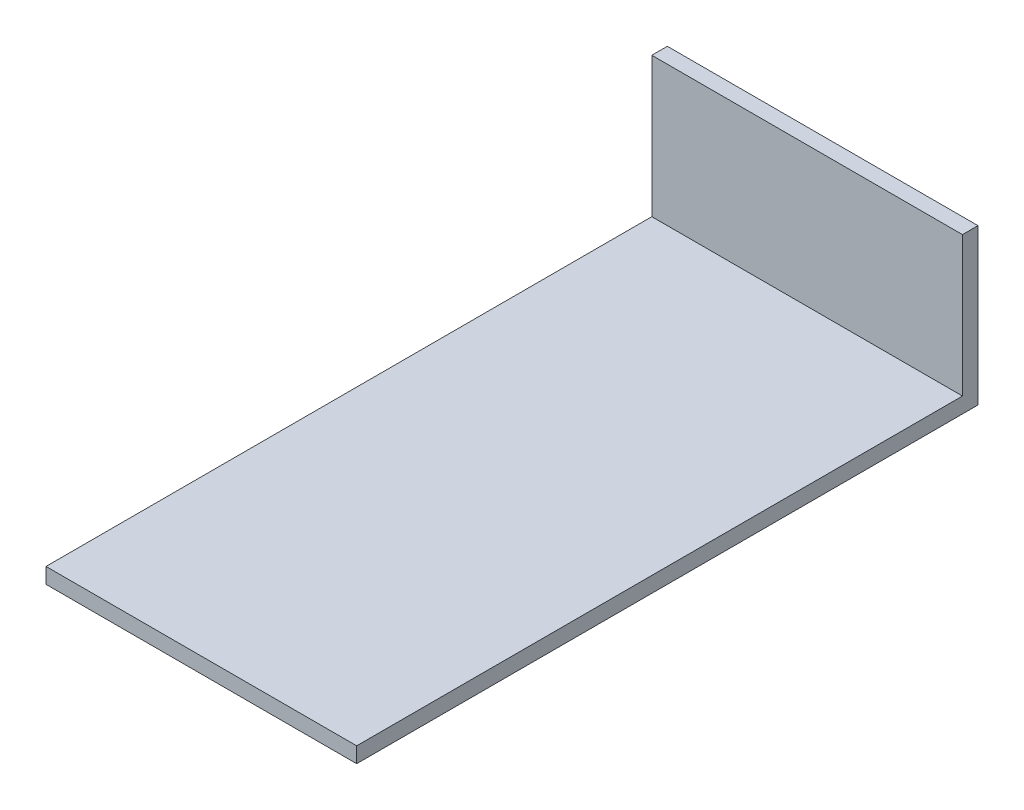
from build123d import *

# Parameters (mm, degrees)
SKETCH1_W           = 25.4
SKETCH1_H           = 12.7
BOSS_EXTRUDE1_DEPTH = 50.8
SHELL1_T            = -1.27


with BuildPart() as part:
    # Sketch1 → Boss-Extrude1 (new body)
    with BuildSketch(Plane.XY):
        Rectangle(SKETCH1_W, SKETCH1_H)
    extrude(amount=BOSS_EXTRUDE1_DEPTH)

    # Shell1
    shell1_openings = [part.faces().sort_by_distance(p)[0] for p in [
        (0, 0, 50.8),
        (-12.7, 0, 25.4),
        (0, 6.35, 25.4),
        (12.7, 0, 25.4),
    ]]
    offset(amount=SHELL1_T, openings=shell1_openings, kind=Kind.INTERSECTION)


solid = part.part
